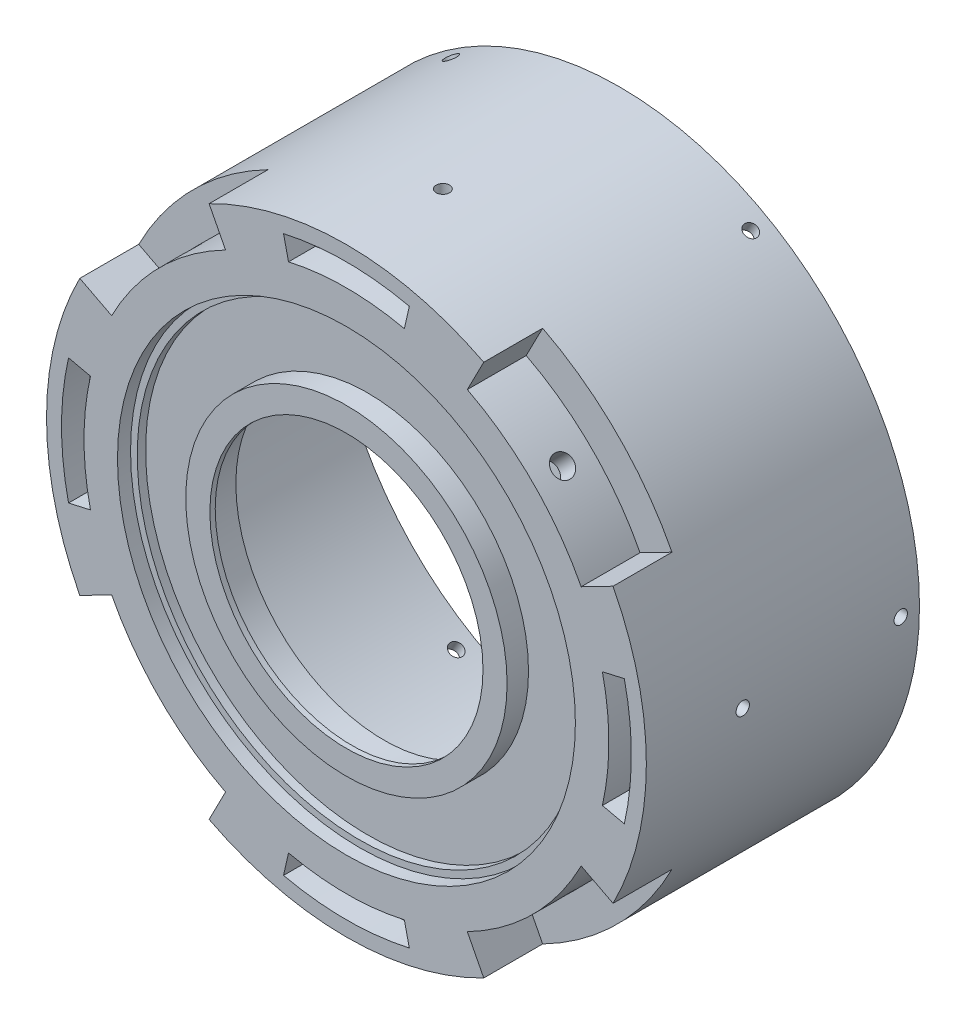
from build123d import *

# Parameters (mm, degrees)
SKETCH1_R                      = 56
SKETCH1_R_2                    = 54
BOSS_EXTRUDE1_DEPTH            = 51
BOSS_EXTRUDE3_START            = -3
SKETCH3_R                      = 54
SKETCH3_R_2                    = 27.65
BOSS_EXTRUDE3_DEPTH            = 3
BOSS_EXTRUDE4_START            = -1
SKETCH3_3_R                    = 27.65
SKETCH3_3_R_2                  = 25.5
BOSS_EXTRUDE4_DEPTH            = 1
BOSS_EXTRUDE5_START            = 4
SKETCH4_R                      = 54
SKETCH4_R_2                    = 32.65
SKETCH4_R_3                    = 27.65
BOSS_EXTRUDE5_DEPTH            = 4
BOSS_EXTRUDE6_START            = 6
SKETCH5_R                      = 54
SKETCH5_R_2                    = 45
BOSS_EXTRUDE6_DEPTH            = 6
CUT_EXTRUDE2_DEPTH             = 5
CUT_EXTRUDE3_START             = -8
CUT_EXTRUDE3_DEPTH             = 5
CUT_EXTRUDE4_START             = -11
CUT_EXTRUDE4_DEPTH             = 11
CIRPATTERN1_COUNT              = 4
SKETCH8_R                      = 2
CUT_EXTRUDE5_DEPTH             = 4
CIRPATTERN2_COUNT              = 4
CUT_EXTRUDE6_REACH             = 145.446
SKETCH10_R                     = 1.25
CUT_EXTRUDE6_DIRECTION_2_DEPTH = 144.44584812
CIRPATTERN3_COUNT              = 6
CUT_EXTRUDE7_REACH             = 137.207
CUT_EXTRUDE7_END_RADIUS        = 54
SKETCH11_R                     = 1.25
CIRPATTERN4_COUNT              = 4
SKETCH12_R                     = 42.75
SKETCH12_R_2                   = 30
CUT_EXTRUDE8_DEPTH             = 4
BOSS_EXTRUDE7_START            = 1.56
SKETCH13_R                     = 42.75
SKETCH13_R_2                   = 41.5
BOSS_EXTRUDE7_DEPTH            = 1.56


with BuildPart() as part:
    # Sketch1 → Boss-Extrude1 (new body)
    with BuildSketch(Plane.XY):
        Circle(SKETCH1_R)
        Circle(SKETCH1_R_2, mode=Mode.SUBTRACT)
    extrude(amount=BOSS_EXTRUDE1_DEPTH)

    # Sketch3 → Boss-Extrude3 (add)
    with BuildSketch(Plane.XY.offset(51).offset(BOSS_EXTRUDE3_START)):
        Circle(SKETCH3_R)
        Circle(SKETCH3_R_2, mode=Mode.SUBTRACT)
    extrude(amount=BOSS_EXTRUDE3_DEPTH)

    # Sketch3<3> → Boss-Extrude4 (add)
    with BuildSketch(Plane.XY.offset(51).offset(BOSS_EXTRUDE4_START)):
        Circle(SKETCH3_3_R)
        Circle(SKETCH3_3_R_2, mode=Mode.SUBTRACT)
    extrude(amount=BOSS_EXTRUDE4_DEPTH)

    # Sketch4 → Boss-Extrude5 (add)
    # profile 1 of 2: a face of its own
    with BuildSketch(Plane(origin=(0, 0, 48), x_dir=(-1, 0, 0), z_dir=(0, 0, -1)).offset(BOSS_EXTRUDE5_START)):
        Circle(SKETCH4_R)
        Circle(SKETCH4_R_2, mode=Mode.SUBTRACT)
    # profile 2 of 2: a face of its own
    with BuildSketch(Plane(origin=(0, 0, 48), x_dir=(-1, 0, 0), z_dir=(0, 0, -1)).offset(BOSS_EXTRUDE5_START)):
        Circle(SKETCH4_R_2)
        with Locations(Location((0, 0, 0), (0, 0, 180))):
            Circle(SKETCH4_R_3, mode=Mode.SUBTRACT)
    extrude(amount=-BOSS_EXTRUDE5_DEPTH)

    # Sketch5 → Boss-Extrude6 (add)
    with BuildSketch(Plane(origin=(0, 0, 44), x_dir=(-1, 0, 0), z_dir=(0, 0, -1)).offset(BOSS_EXTRUDE6_START)):
        Circle(SKETCH5_R)
        Circle(SKETCH5_R_2, mode=Mode.SUBTRACT)
    extrude(amount=-BOSS_EXTRUDE6_DEPTH)

    # Sketch6 → Cut-Extrude2 (cut)
    with BuildSketch(Plane(origin=(0, 0, 38), x_dir=(-1, 0, 0), z_dir=(0, 0, -1))):
        with BuildLine():
            Line((-11.741103543, 51.888211451), (-10.814174316, 47.791773705))
            ThreePointArc((-10.814174316, 47.791773705), (0, 49), (10.814174316, 47.791773705))
            Line((10.814174316, 47.791773705), (11.741103543, 51.888211451))
            ThreePointArc((11.741103543, 51.888211451), (0, 53.2), (-11.741103543, 51.888211451))
        make_face()
        with BuildLine():
            ThreePointArc((-47.791773705, -10.814174316), (-49, 0), (-47.791773705, 10.814174316))
            Line((-47.791773705, 10.814174316), (-51.888211451, 11.741103543))
            ThreePointArc((-51.888211451, 11.741103543), (-53.2, 0), (-51.888211451, -11.741103543))
            Line((-51.888211451, -11.741103543), (-47.791773705, -10.814174316))
        make_face()
        with BuildLine():
            Line((51.888211451, 11.741103543), (47.791773705, 10.814174316))
            ThreePointArc((47.791773705, 10.814174316), (49, 0), (47.791773705, -10.814174316))
            Line((47.791773705, -10.814174316), (51.888211451, -11.741103543))
            ThreePointArc((51.888211451, -11.741103543), (53.2, 0), (51.888211451, 11.741103543))
        make_face()
        with BuildLine():
            ThreePointArc((10.814174316, -47.791773705), (0, -49), (-10.814174316, -47.791773705))
            Line((-10.814174316, -47.791773705), (-11.741103543, -51.888211451))
            ThreePointArc((-11.741103543, -51.888211451), (0, -53.2), (11.741103543, -51.888211451))
            Line((11.741103543, -51.888211451), (10.814174316, -47.791773705))
        make_face()
    extrude(amount=-CUT_EXTRUDE2_DEPTH, mode=Mode.SUBTRACT)

    # Sketch6<3> → Cut-Extrude3 (cut)
    with BuildSketch(Plane(origin=(0, 0, 38), x_dir=(-1, 0, 0), z_dir=(0, 0, -1)).offset(CUT_EXTRUDE3_START)):
        with BuildLine():
            Line((-11.741103543, 51.888211451), (-10.814174316, 47.791773705))
            ThreePointArc((-10.814174316, 47.791773705), (0, 49), (10.814174316, 47.791773705))
            Line((10.814174316, 47.791773705), (11.741103543, 51.888211451))
            ThreePointArc((11.741103543, 51.888211451), (0, 53.2), (-11.741103543, 51.888211451))
        make_face()
        with BuildLine():
            ThreePointArc((-47.791773705, -10.814174316), (-49, 0), (-47.791773705, 10.814174316))
            Line((-47.791773705, 10.814174316), (-51.888211451, 11.741103543))
            ThreePointArc((-51.888211451, 11.741103543), (-53.2, 0), (-51.888211451, -11.741103543))
            Line((-51.888211451, -11.741103543), (-47.791773705, -10.814174316))
        make_face()
        with BuildLine():
            Line((51.888211451, 11.741103543), (47.791773705, 10.814174316))
            ThreePointArc((47.791773705, 10.814174316), (49, 0), (47.791773705, -10.814174316))
            Line((47.791773705, -10.814174316), (51.888211451, -11.741103543))
            ThreePointArc((51.888211451, -11.741103543), (53.2, 0), (51.888211451, 11.741103543))
        make_face()
        with BuildLine():
            ThreePointArc((10.814174316, -47.791773705), (0, -49), (-10.814174316, -47.791773705))
            Line((-10.814174316, -47.791773705), (-11.741103543, -51.888211451))
            ThreePointArc((-11.741103543, -51.888211451), (0, -53.2), (11.741103543, -51.888211451))
            Line((11.741103543, -51.888211451), (10.814174316, -47.791773705))
        make_face()
    extrude(amount=-CUT_EXTRUDE3_DEPTH, mode=Mode.SUBTRACT)

    # Sketch7 → Cut-Extrude4 (cut)
    with BuildSketch(Plane.XY.offset(51).offset(CUT_EXTRUDE4_START)):
        with BuildLine():
            Line((-25.640939247, 49.784959923), (-22.573184015, 43.828545075))
            ThreePointArc((-22.573184015, 43.828545075), (-34.860364312, 34.860364312), (-43.828545075, 22.573184015))
            Line((-43.828545075, 22.573184015), (-49.784959923, 25.640939247))
            ThreePointArc((-49.784959923, 25.640939247), (-39.597979746, 39.597979746), (-25.640939247, 49.784959923))
        make_face()
    cut_extrude4 = extrude(amount=CUT_EXTRUDE4_DEPTH, mode=Mode.SUBTRACT)

    # CirPattern1: Cut-Extrude4 ×4 about axis
    cirpattern1_axis = Axis((0, 0, 0), (0, 0, -1))
    for i in range(1, CIRPATTERN1_COUNT):
        add(cut_extrude4.rotate(cirpattern1_axis, i * 360 / CIRPATTERN1_COUNT), mode=Mode.SUBTRACT)

    # Sketch8 → Cut-Extrude5 (cut)
    with BuildSketch(Plane(origin=(-34.860364312, 34.860364312, 0), x_dir=(0, 0, 1), z_dir=(-0.7071067811865515, 0.7071067811865436, 0))):
        with Locations(Location((45.5, 0, 0), (0, 0, 270))):
            Circle(SKETCH8_R)
    cut_extrude5 = extrude(amount=-CUT_EXTRUDE5_DEPTH, mode=Mode.SUBTRACT)

    # CirPattern2: Cut-Extrude5 ×4 about axis
    cirpattern2_axis = Axis((0, 0, 0), (0, 0, 1))
    for i in range(1, CIRPATTERN2_COUNT):
        add(cut_extrude5.rotate(cirpattern2_axis, i * 360 / CIRPATTERN2_COUNT), mode=Mode.SUBTRACT)

    # Sketch10 → Cut-Extrude6 (cut, up to next)
    with BuildSketch(Plane(origin=(-28, 48.497422612, 0), x_dir=(0.8660254037844382, 0.5000000000000009, 0), z_dir=(-0.5000000000000009, 0.8660254037844383, 0)), mode=Mode.PRIVATE) as cut_extrude6_sk1:
        with Locations(Location((0, -3.5, 0), (0, 0, 180))):
            Circle(SKETCH10_R)
    cut_extrude6_tool1 = extrude(cut_extrude6_sk1.sketch, amount=-CUT_EXTRUDE6_REACH, mode=Mode.PRIVATE) & part.part
    cut_extrude6 = cut_extrude6_tool1.solids().sort_by_distance((-28, 48.497423, 3.5))[0]
    add(cut_extrude6, mode=Mode.SUBTRACT)

    # Sketch10 → Cut-Extrude6 direction 2 (cut)
    with BuildSketch(Plane(origin=(-28, 48.497422612, 0), x_dir=(0.8660254037844382, 0.5000000000000009, 0), z_dir=(-0.5000000000000009, 0.8660254037844383, 0))):
        with Locations(Location((0, -3.5, 0), (0, 0, 180))):
            Circle(SKETCH10_R)
    cut_extrude6_direction_2 = extrude(amount=CUT_EXTRUDE6_DIRECTION_2_DEPTH, mode=Mode.SUBTRACT)

    # CirPattern3: Cut-Extrude6, Cut-Extrude6 direction 2 ×6 about axis
    cirpattern3_axis = Axis((0, 0, 0), (0, 0, 1))
    add([cut_extrude6.rotate(cirpattern3_axis, i * 360 / CIRPATTERN3_COUNT) for i in range(1, CIRPATTERN3_COUNT)], mode=Mode.SUBTRACT)
    add([cut_extrude6_direction_2.rotate(cirpattern3_axis, i * 360 / CIRPATTERN3_COUNT) for i in range(1, CIRPATTERN3_COUNT)], mode=Mode.SUBTRACT)

    # Cut-Extrude7: up to this cylinder (the profile starts outside it)
    cut_extrude7_end = Plane(origin=(0, 0, 33), z_dir=(0, 0, -1)) * Cylinder(CUT_EXTRUDE7_END_RADIUS, 383.414, mode=Mode.PRIVATE)
    # Sketch11 → Cut-Extrude7 (cut, up to the surface)
    with BuildSketch(Plane(origin=(0, 56, 0), x_dir=(1, 0, 0), z_dir=(0, 1, 0)), mode=Mode.PRIVATE) as cut_extrude7_sk1:
        with Locations(Location((0, -33, 0), (0, 0, 270))):
            Circle(SKETCH11_R)
    cut_extrude7_tool1 = extrude(cut_extrude7_sk1.sketch, amount=-CUT_EXTRUDE7_REACH, mode=Mode.PRIVATE) - cut_extrude7_end
    cut_extrude7 = cut_extrude7_tool1.solids().sort_by_distance((0, 56, 33))[0]
    add(cut_extrude7, mode=Mode.SUBTRACT)

    # CirPattern4: Cut-Extrude7 ×4 about axis
    cirpattern4_axis = Axis((0, 0, 0), (0, 0, -1))
    for i in range(1, CIRPATTERN4_COUNT):
        add(cut_extrude7.rotate(cirpattern4_axis, i * 360 / CIRPATTERN4_COUNT), mode=Mode.SUBTRACT)

    # Sketch12 → Cut-Extrude8 (cut)
    with BuildSketch(Plane.XY.offset(51)):
        Circle(SKETCH12_R)
        Circle(SKETCH12_R_2, mode=Mode.SUBTRACT)
    extrude(amount=-CUT_EXTRUDE8_DEPTH, mode=Mode.SUBTRACT)

    # Sketch13 → Boss-Extrude7 (add)
    with BuildSketch(Plane.XY.offset(47).offset(BOSS_EXTRUDE7_START)):
        Circle(SKETCH13_R)
        Circle(SKETCH13_R_2, mode=Mode.SUBTRACT)
    extrude(amount=-BOSS_EXTRUDE7_DEPTH)


solid = part.part
